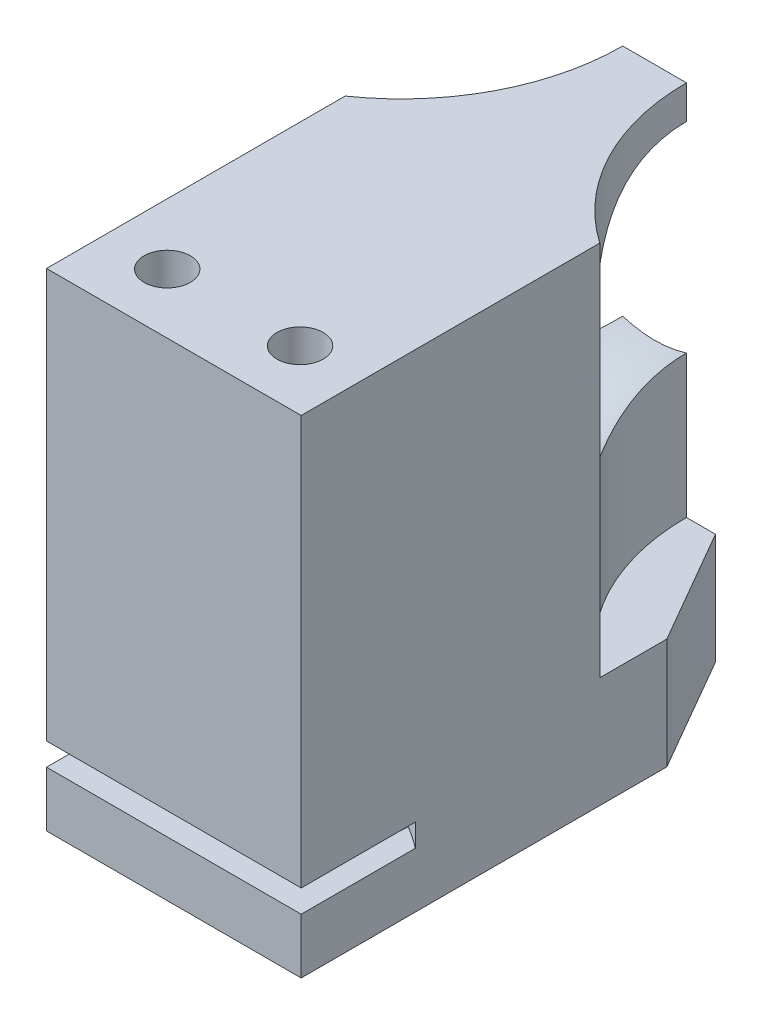
from build123d import *
from build123d.topology import SkipClean

# Parameters (mm, degrees)
SKETCH1_W               = 29.21
SKETCH1_H               = 55.1434
BOSS_EXTRUDE1_DEPTH     = 55.88
SKETCH2_R               = 12.065
CUT_REVOLVE1_ANGLE      = 90
SKETCH3_R               = 25.4
CUT_EXTRUDE1_DEPTH      = 43.18
CUT_EXTRUDE4_DEPTH      = 2.0955
CUT_EXTRUDE4_DEPTH_BACK = 0.508
SKETCH6_R               = 23.8125
SKETCH7_R               = 2.6543
CUT_EXTRUDE5_DEPTH      = 7.62
CHAMFER1_SIZE           = 7.62
CHAMFER1_SIZE2          = 13.198227154
SKETCH8_R               = 2.6543
CUT_EXTRUDE6_DEPTH      = 7.62
SKETCH9_R               = 2.6543
CUT_EXTRUDE7_DEPTH      = 7.62


with BuildPart() as part:
    # Sketch1 → Boss-Extrude1 (new body)
    with BuildSketch(Plane(origin=(0, 0, 0), x_dir=(1, 0, 0), z_dir=(0, 1, 0))):
        with Locations((0, -27.5717)):
            Rectangle(SKETCH1_W, SKETCH1_H)
    extrude(amount=BOSS_EXTRUDE1_DEPTH)

    # Sketch2 → Cut-Revolve1 (revolve, cut)
    with BuildSketch(Plane(origin=(0, 0, 0), x_dir=(-1, 0, 0), z_dir=(0, 0, -1))):
        with Locations((0, 40.5384)):
            Circle(SKETCH2_R)
    revolve(axis=Axis((14.605, 0, 0), (1, 0, 0)), revolution_arc=CUT_REVOLVE1_ANGLE, mode=Mode.SUBTRACT)

    # Sketch3 → Cut-Extrude1 (cut)
    with BuildSketch(Plane(origin=(0, 55.88, 0), x_dir=(1, 0, 0), z_dir=(0, 1, 0))):
        with Locations((-29.0576, 0)):
            Circle(SKETCH3_R)
        with Locations((29.0576, 0)):
            Circle(SKETCH3_R)
    extrude(amount=-CUT_EXTRUDE1_DEPTH, mode=Mode.SUBTRACT)

    # Sketch6 → Cut-Extrude4 (cut, two sides: drawn at the far end of the back side and taken through both)
    with SkipClean():  # the faces are left unmerged after this step: merging them gives an invalid solid
        with BuildSketch(Plane(origin=(0, 8.4328, 0), x_dir=(-1, 0, 0), z_dir=(0, -1, 0)).offset(-CUT_EXTRUDE4_DEPTH_BACK)):
            with Locations((0, -60.8584)):
                Circle(SKETCH6_R)
        extrude(amount=CUT_EXTRUDE4_DEPTH + CUT_EXTRUDE4_DEPTH_BACK, mode=Mode.SUBTRACT)

    # Sketch7 → Cut-Extrude5 (cut)
    with SkipClean():  # the faces are left unmerged after this step: merging them gives an invalid solid
        with BuildSketch(Plane.XZ):
            with Locations((0, 6.35)):
                Circle(SKETCH7_R)
            with Locations((-8.128, 21.59)):
                Circle(SKETCH7_R)
            with Locations((8.128, 21.59)):
                Circle(SKETCH7_R)
        extrude(amount=-CUT_EXTRUDE5_DEPTH, mode=Mode.SUBTRACT)

    # Chamfer1
    chamfer1_edges = [part.edges().sort_by_distance(p)[0] for p in [
        (14.605, 6.35, 0),
        (-14.605, 6.35, 0),
    ]]
    chamfer1_side = [part.faces().sort_by_distance(p)[0] for p in [
        (0, 9.780788916, 0),
    ]]
    chamfer(chamfer1_edges, length=CHAMFER1_SIZE, length2=CHAMFER1_SIZE2, reference=chamfer1_side[0])

    # Sketch8 → Cut-Extrude6 (cut)
    with SkipClean():  # the faces are left unmerged after this step: merging them gives an invalid solid
        with BuildSketch(Plane(origin=(0, 55.88, 0), x_dir=(1, 0, 0), z_dir=(0, 1, 0))):
            with Locations((-7.62, -48.2854)):
                Circle(SKETCH8_R)
            with Locations((7.62, -48.2854)):
                Circle(SKETCH8_R)
        extrude(amount=-CUT_EXTRUDE6_DEPTH, mode=Mode.SUBTRACT)

    # Sketch9 → Cut-Extrude7 (cut)
    with SkipClean():  # the faces are left unmerged after this step: merging them gives an invalid solid
        with BuildSketch(Plane.ZY.offset(14.605)):
            with Locations((47.5234, 43.18)):
                Circle(SKETCH9_R)
            with Locations((47.5234, 30.48)):
                Circle(SKETCH9_R)
        extrude(amount=-CUT_EXTRUDE7_DEPTH, mode=Mode.SUBTRACT)


solid = part.part
